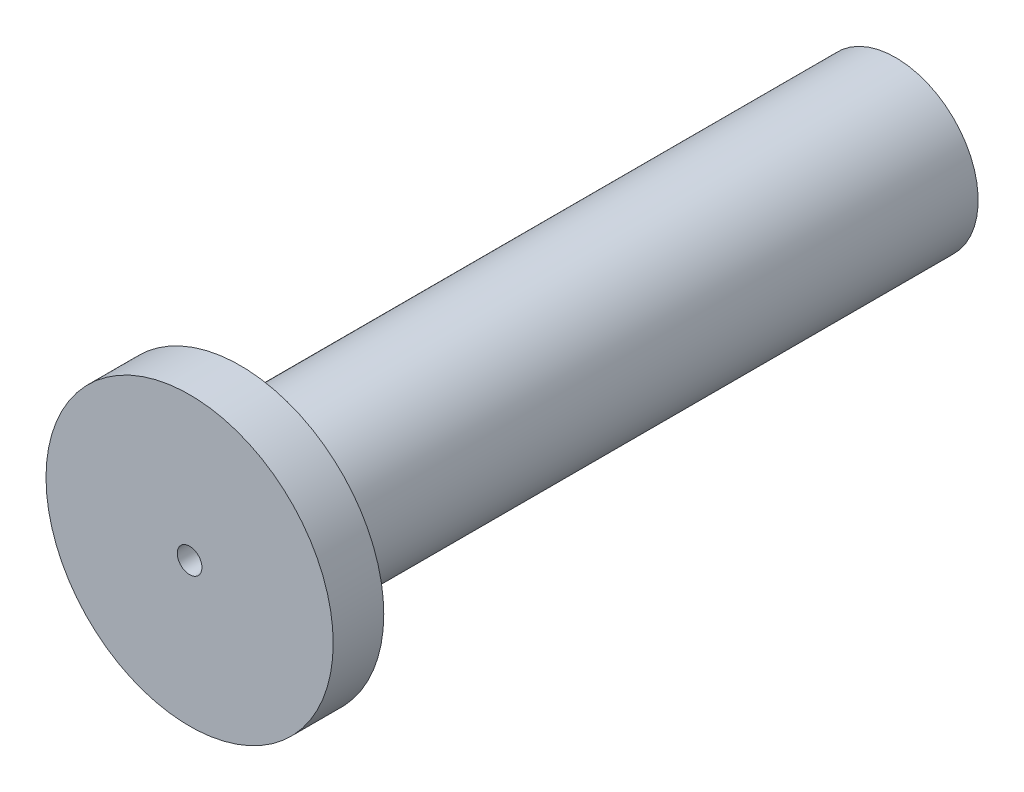
from build123d import *

# Parameters (mm, degrees)
CUT_EXTRUDE1_REACH = 119.684
SKETCH2_R          = 1.975


with BuildPart() as part:
    # Sketch1 → Revolve1 (revolve)
    with BuildSketch(Plane(origin=(0, 0, 0), x_dir=(1, 0, 0), z_dir=(0, 1, 0)), mode=Mode.PRIVATE) as revolve1_sk:
        Polygon((0, 0), (23, 0), (23, 8.1), (13.2, 8.1), (13.2, 113.1), (10.2, 113.1), (10.2, 8.1), (0, 8.1), align=None)
    revolve(revolve1_sk.sketch.rotate(Axis((0, 0, -8.1), (0, 0, 1)), 180), axis=Axis((0, 0, -8.1), (0, 0, 1)))

    # Sketch2 → Cut-Extrude1 (cut, up to next)
    with BuildSketch(Plane.XY, mode=Mode.PRIVATE) as cut_extrude1_sk1:
        Circle(SKETCH2_R)
    cut_extrude1_tool1 = extrude(cut_extrude1_sk1.sketch, amount=-CUT_EXTRUDE1_REACH, mode=Mode.PRIVATE) & part.part
    add(cut_extrude1_tool1.solids().sort_by_distance((0, 0, 0))[0], mode=Mode.SUBTRACT)


solid = part.part
